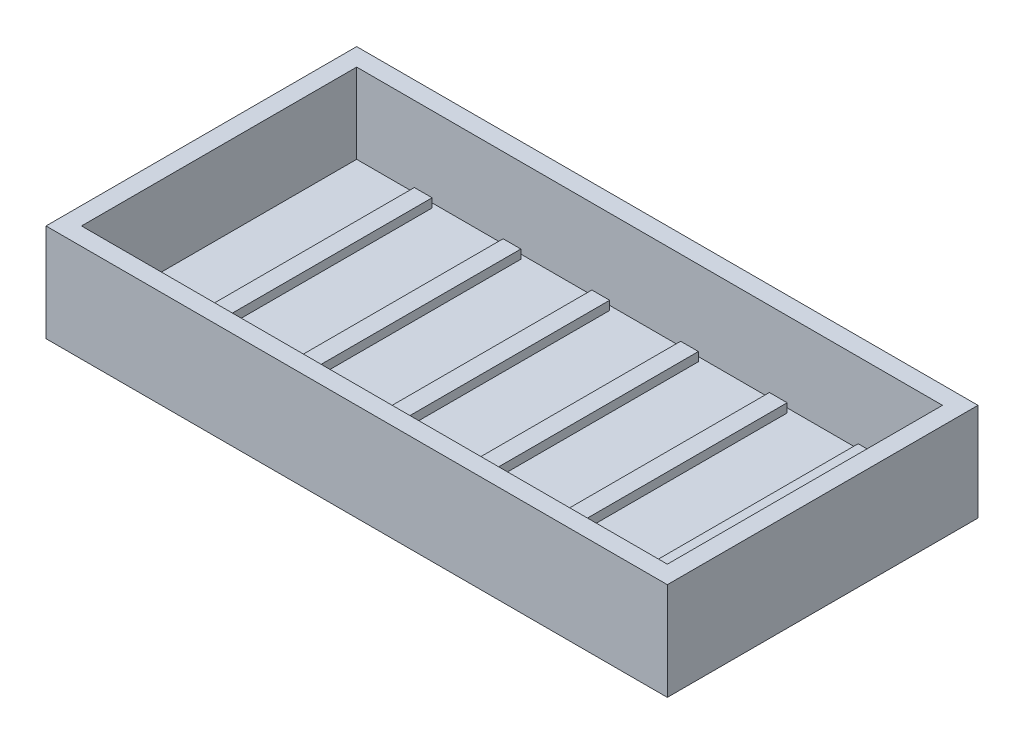
from build123d import *

# Parameters (mm, degrees)
SKETCH1_W         = 140
SKETCH1_H         = 70
TRAY_DEPTH        = 22
BASIN_START       = 22
SKETCH2_W         = 132
SKETCH2_H         = 62
BASIN_DEPTH       = 18
GRILLE_RIBS_START = 4
SKETCH3_W         = 4
SKETCH3_H         = 60
GRILLE_RIBS_DEPTH = 2


with BuildPart() as part:
    # Sketch1 → Tray (new body)
    with BuildSketch(Plane(origin=(0, 0, 0), x_dir=(1, 0, 0), z_dir=(0, 1, 0))):
        with Locations((0, -35)):
            Rectangle(SKETCH1_W, SKETCH1_H)
    extrude(amount=TRAY_DEPTH)

    # Sketch2 → Basin (cut)
    with BuildSketch(Plane(origin=(0, 0, 0), x_dir=(1, 0, 0), z_dir=(0, 1, 0)).offset(BASIN_START)):
        with Locations((0, -35)):
            Rectangle(SKETCH2_W, SKETCH2_H)
    extrude(amount=-BASIN_DEPTH, mode=Mode.SUBTRACT)

    # Sketch3 → Grille_Ribs (add)
    with BuildSketch(Plane(origin=(0, 0, 0), x_dir=(1, 0, 0), z_dir=(0, 1, 0)).offset(GRILLE_RIBS_START)):
        with Locations((-50, -35)):
            Rectangle(SKETCH3_W, SKETCH3_H)
        with Locations((-30, -35)):
            Rectangle(SKETCH3_W, SKETCH3_H)
        with Locations((-10, -35)):
            Rectangle(SKETCH3_W, SKETCH3_H)
        with Locations((10, -35)):
            Rectangle(SKETCH3_W, SKETCH3_H)
        with Locations((30, -35)):
            Rectangle(SKETCH3_W, SKETCH3_H)
        with Locations((50, -35)):
            Rectangle(SKETCH3_W, SKETCH3_H)
    extrude(amount=GRILLE_RIBS_DEPTH)


solid = part.part
